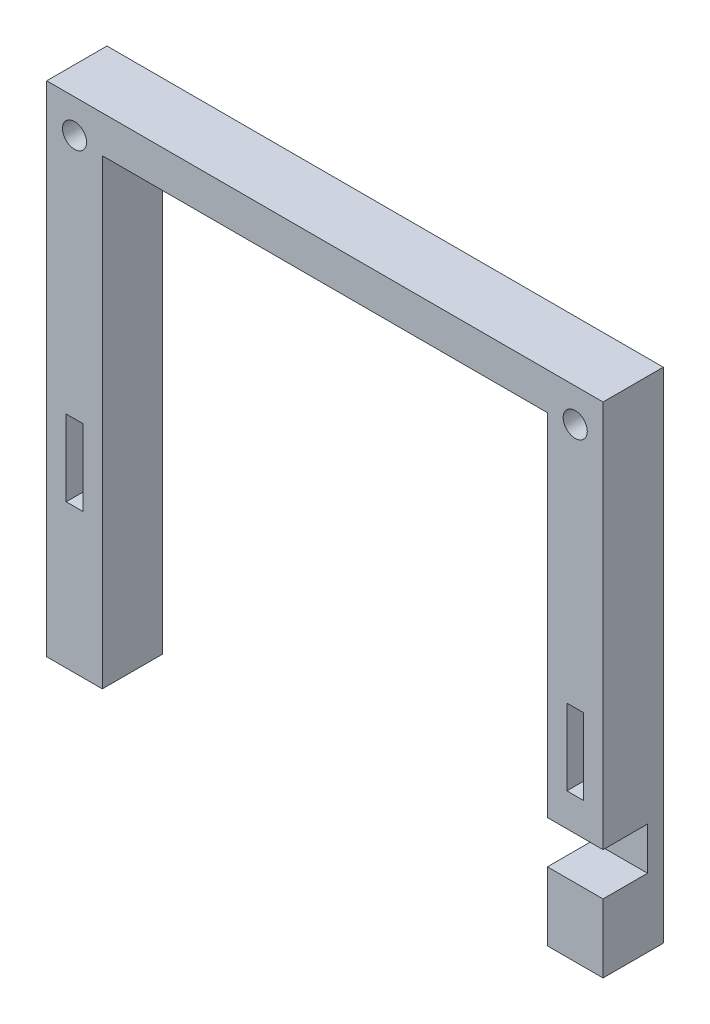
from build123d import *

# Parameters (mm, degrees)
SKETCH2_W           = 150
SKETCH2_H           = 134.5
SKETCH2_W_2         = 120
SKETCH2_H_2         = 114.5
BOSS_EXTRUDE1_DEPTH = 152
SKETCH3_R           = 3.25
CUT_EXTRUDE1_DEPTH  = 27.5
SKETCH4_W           = 120
SKETCH4_H           = 10.090135052
CUT_EXTRUDE2_DEPTH  = 192.859758942
SKETCH5_W           = 9.929816524
SKETCH5_H           = 99.5
SKETCH5_W_2         = 106.146314573
SKETCH5_H_2         = 4.565432885
SKETCH5_W_3         = 9.245001591
CUT_EXTRUDE3_DEPTH  = 140
SKETCH6_W           = 5
SKETCH6_H           = 99.5
BOSS_EXTRUDE2_DEPTH = 10
SKETCH7_W           = 106.146314573
SKETCH7_H           = 5
BOSS_EXTRUDE3_DEPTH = 6
SKETCH8_W           = 5
SKETCH8_H           = 99.5
BOSS_EXTRUDE4_DEPTH = 10
SKETCH9_R           = 3.25
CUT_EXTRUDE4_DEPTH  = 5
SKETCH11_W          = 12
SKETCH11_H          = 11.501568892
CUT_EXTRUDE5_DEPTH  = 35
SKETCH12_W          = 6.942410631
SKETCH12_H          = 9.961568892
BOSS_EXTRUDE5_DEPTH = 9.5
SKETCH13_W          = 4.5
SKETCH13_H          = 20.5
CUT_EXTRUDE6_DEPTH  = 15
SKETCH14_W          = 137.41211241
SKETCH14_H          = 135.633574501
CUT_EXTRUDE7_DEPTH  = 226.792628158


with BuildPart() as part:
    # Sketch2 → Boss-Extrude1 (new body)
    with BuildSketch(Plane.XY):
        with Locations((16.257088332, -6.086968375)):
            Rectangle(SKETCH2_W, SKETCH2_H)
        with Locations((16.257088332, -6.086968375)):
            Rectangle(SKETCH2_W_2, SKETCH2_H_2, mode=Mode.SUBTRACT)
    extrude(amount=BOSS_EXTRUDE1_DEPTH)

    # Sketch3 → Cut-Extrude1 (cut)
    with BuildSketch(Plane.XY.offset(152)):
        with Locations((-51.242911668, 52.163031625)):
            Circle(SKETCH3_R)
        with Locations((83.757088332, 52.163031625)):
            Circle(SKETCH3_R)
    extrude(amount=-CUT_EXTRUDE1_DEPTH, mode=Mode.SUBTRACT)

    # Sketch4 → Cut-Extrude2 (cut, through all)
    with BuildSketch(Plane.XY.offset(152)):
        with Locations((16.257088332, -68.382035901)):
            Rectangle(SKETCH4_W, SKETCH4_H)
    extrude(amount=-CUT_EXTRUDE2_DEPTH, mode=Mode.SUBTRACT)

    # Sketch5 → Cut-Extrude3 (cut)
    with BuildSketch(Plane.XY.offset(152)):
        with Locations((-51.653725831, -3.586968375)):
            Rectangle(SKETCH5_W, SKETCH5_H)
        with Locations((16.314156243, 56.459462148)):
            Rectangle(SKETCH5_W_2, SKETCH5_H_2)
        with Locations((83.825495028, -3.586968375)):
            Rectangle(SKETCH5_W_3, SKETCH5_H)
    extrude(amount=-CUT_EXTRUDE3_DEPTH, mode=Mode.SUBTRACT)

    # Sketch6 → Boss-Extrude2 (add)
    with BuildSketch(Plane.ZY.offset(46.688817569)):
        with Locations((149.5, -3.586968375)):
            Rectangle(SKETCH6_W, SKETCH6_H)
    extrude(amount=BOSS_EXTRUDE2_DEPTH)

    # Sketch7 → Boss-Extrude3 (add)
    with BuildSketch(Plane(origin=(0, 54.176745705, 0), x_dir=(1, 0, 0), z_dir=(0, 1, 0))):
        with Locations((16.314156243, -149.5)):
            Rectangle(SKETCH7_W, SKETCH7_H)
    extrude(amount=BOSS_EXTRUDE3_DEPTH)

    # Sketch8 → Boss-Extrude4 (add)
    with BuildSketch(Plane(origin=(79.202994232, 0, 0), x_dir=(0, 0, -1), z_dir=(1, 0, 0))):
        with Locations((-149.5, -3.586968375)):
            Rectangle(SKETCH8_W, SKETCH8_H)
    extrude(amount=BOSS_EXTRUDE4_DEPTH)

    # Sketch9 → Cut-Extrude4 (cut)
    with BuildSketch(Plane(origin=(0, 0, 0), x_dir=(-1, 0, 0), z_dir=(0, 0, -1))):
        with Locations((-83.757088332, 56.163031625)):
            Circle(SKETCH9_R)
        with Locations((-83.757088332, -3.836968375)):
            Circle(SKETCH9_R)
        with Locations((51.242911668, -3.836968375)):
            Circle(SKETCH9_R)
        with Locations((51.242911668, 56.163031625)):
            Circle(SKETCH9_R)
    extrude(amount=-CUT_EXTRUDE4_DEPTH, mode=Mode.SUBTRACT)

    # Sketch11 → Cut-Extrude5 (cut)
    with BuildSketch(Plane(origin=(91.257088332, 0, 0), x_dir=(0, 0, -1), z_dir=(1, 0, 0))):
        with Locations((-146, -49.126183929)):
            Rectangle(SKETCH11_W, SKETCH11_H)
    extrude(amount=-CUT_EXTRUDE5_DEPTH, mode=Mode.SUBTRACT)

    # Sketch12 → Boss-Extrude5 (add)
    with BuildSketch(Plane(origin=(79.202994232, 0, 0), x_dir=(0, 0, -1), z_dir=(1, 0, 0))):
        with Locations((-136.528794684, -48.356183929)):
            Rectangle(SKETCH12_W, SKETCH12_H)
    extrude(amount=BOSS_EXTRUDE5_DEPTH)

    # Sketch13 → Cut-Extrude6 (cut)
    with BuildSketch(Plane.XY.offset(152)):
        with Locations((83.757088332, -24.266968375)):
            Rectangle(SKETCH13_W, SKETCH13_H)
        with Locations((-51.242911668, -24.266968375)):
            Rectangle(SKETCH13_W, SKETCH13_H)
    extrude(amount=-CUT_EXTRUDE6_DEPTH, mode=Mode.SUBTRACT)

    # Sketch14 → Cut-Extrude7 (cut, through all)
    with BuildSketch(Plane(origin=(91.257088332, 0, 0), x_dir=(0, 0, -1), z_dir=(1, 0, 0))):
        with Locations((-67.050040254, -6.653755626)):
            Rectangle(SKETCH14_W, SKETCH14_H)
    extrude(amount=-CUT_EXTRUDE7_DEPTH, mode=Mode.SUBTRACT)


solid = part.part
